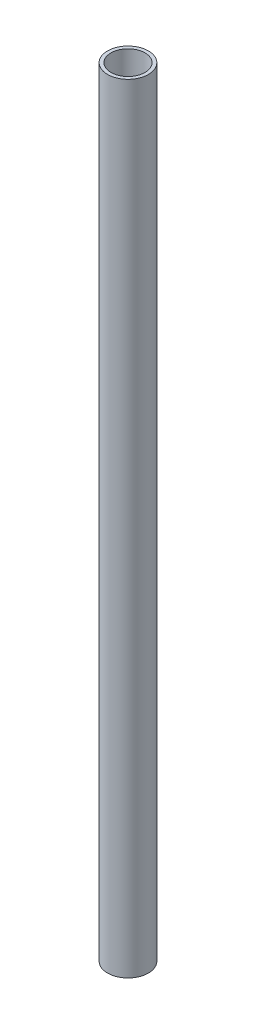
from build123d import *

# Parameters (mm, degrees)
SKETCH1_R           = 9.6
SKETCH1_R_2         = 8
BOSS_EXTRUDE1_DEPTH = 366


with BuildPart() as part:
    # Sketch1 → Boss-Extrude1 (new body)
    with BuildSketch(Plane(origin=(0, 0, 0), x_dir=(1, 0, 0), z_dir=(0, 1, 0))):
        with Locations(Location((0, 0, 0), (0, 0, 270))):
            Circle(SKETCH1_R)
        with Locations(Location((0, 0, 0), (0, 0, 270))):
            Circle(SKETCH1_R_2, mode=Mode.SUBTRACT)
    extrude(amount=BOSS_EXTRUDE1_DEPTH)


solid = part.part
